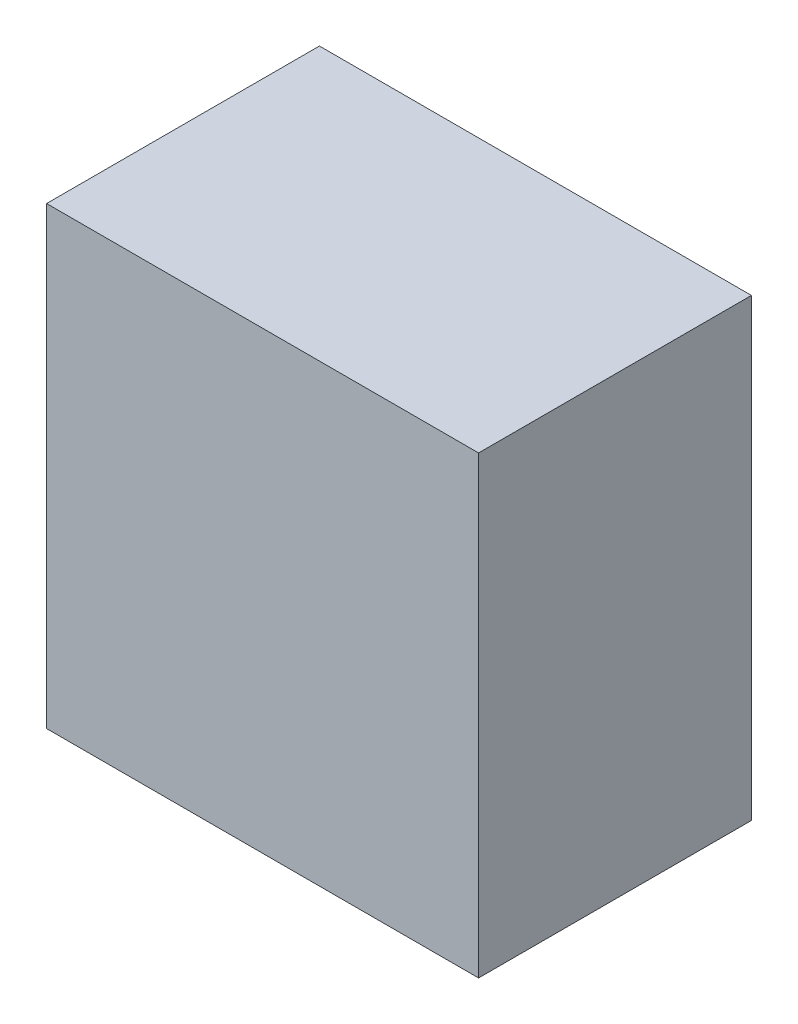
from build123d import *

# Parameters (mm, degrees)
SKETCH1_W      = 723.9
SKETCH1_H      = 457.2
EXTRUDE1_DEPTH = 762


with BuildPart() as part:
    # Sketch1 → Extrude1 (new body)
    with BuildSketch(Plane(origin=(0, 0, 0), x_dir=(1, 0, 0), z_dir=(0, 1, 0))):
        with Locations((361.95, 228.6)):
            Rectangle(SKETCH1_W, SKETCH1_H)
    extrude(amount=EXTRUDE1_DEPTH)


solid = part.part
